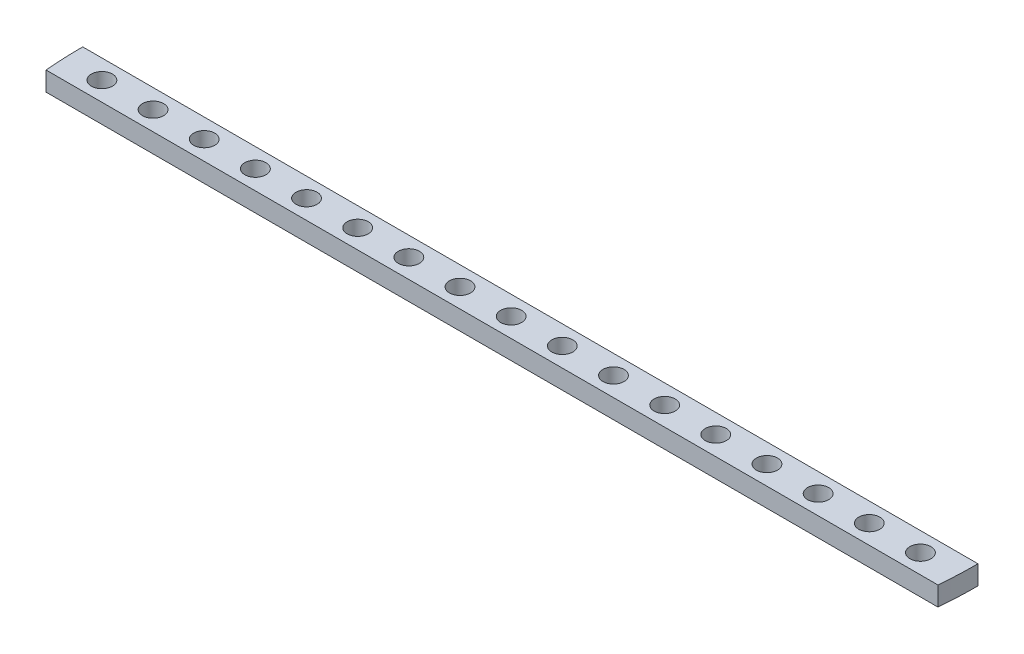
from build123d import *

# Parameters (mm, degrees)
EXTRUDE_1_DEPTH     = 4
CUT_EXTRUDE_1_DEPTH = 10
SKETCH_3_R          = 2.25
CUT_EXTRUDE_2_DEPTH = 10
SKETCH_4_R          = 1.65
CUT_EXTRUDE_3_DEPTH = 10
EXTRUDE_START       = -4
EXTRUDE_2_DEPTH     = 4
SKETCH_6_R          = 1.65
CUT_EXTRUDE_4_DEPTH = 4
SKETCH_7_W          = 40
SKETCH_7_H          = 10
CUT_EXTRUDE_5_DEPTH = 4
EXTRUDE_4_DEPTH     = 4
SKETCH_9_R          = 1.65
SKETCH_9_R_2        = 2.25
SKETCH_9_W          = 20
SKETCH_9_H          = 40
EXTRUDE_7_DEPTH     = 4
CUT_EXTRUDE_START   = -4
SKETCH_10_R         = 2.25
SKETCH_10_W         = 20
SKETCH_10_H         = 40
CUT_EXTRUDE_6_DEPTH = 4
SKETCH_11_R         = 2.25
SKETCH_11_W         = 20
SKETCH_11_H         = 40
SKETCH_11_W_2       = 40
SKETCH_11_H_2       = 20
SKETCH_11_R_2       = 1.65
CUT_EXTRUDE_7_DEPTH = 4
SKETCH_12_W         = 140
SKETCH_12_H         = 1
CUT_EXTRUDE_8_DEPTH = 10


with BuildPart() as part:
    # 草图1 → 凸台-拉伸1 (new body)
    with BuildSketch(Plane(origin=(0, 0, 0), x_dir=(1, 0, 0), z_dir=(0, 1, 0))):
        with BuildLine():
            Line((-50, 0), (50, 0))
            ThreePointArc((50, 0), (0, -50), (-50, 0))
        make_face()
    extrude(amount=EXTRUDE_1_DEPTH)

    # 草图2 → 切除-拉伸1 (cut)
    with BuildSketch(Plane(origin=(0, 4, 0), x_dir=(1, 0, 0), z_dir=(0, 1, 0))):
        Polygon((0, -10.623043888), (10, -10.623043888), (10, -30.623043888), (-30, -30.623043888), (-30, -10.623043888), align=None)
    extrude(amount=-CUT_EXTRUDE_1_DEPTH, mode=Mode.SUBTRACT)

    # 草图3 → 切除-拉伸2 (cut)
    with BuildSketch(Plane(origin=(0, 4, 0), x_dir=(1, 0, 0), z_dir=(0, 1, 0))):
        with Locations(Location((-34.75, -15.623043888, 0), (0, 0, 270))):
            Circle(SKETCH_3_R)
        with Locations(Location((-34.75, -25.623043888, 0), (0, 0, 270))):
            Circle(SKETCH_3_R)
        with Locations(Location((14.75, -25.623043888, 0), (0, 0, 90))):
            Circle(SKETCH_3_R)
        with Locations(Location((14.75, -15.623043888, 0), (0, 0, 90))):
            Circle(SKETCH_3_R)
    extrude(amount=-CUT_EXTRUDE_2_DEPTH, mode=Mode.SUBTRACT)

    # 草图4 → 切除-拉伸3 (cut)
    with BuildSketch(Plane(origin=(0, 4, 0), x_dir=(1, 0, 0), z_dir=(0, 1, 0))):
        with Locations(Location((0, -3, 0), (0, 0, 270))):
            Circle(SKETCH_4_R)
        with Locations(Location((8, -3, 0), (0, 0, 270))):
            Circle(SKETCH_4_R)
        with Locations(Location((16, -3, 0), (0, 0, 270))):
            Circle(SKETCH_4_R)
        with Locations(Location((24, -3, 0), (0, 0, 270))):
            Circle(SKETCH_4_R)
        with Locations(Location((32, -3, 0), (0, 0, 270))):
            Circle(SKETCH_4_R)
        with Locations(Location((40, -3, 0), (0, 0, 270))):
            Circle(SKETCH_4_R)
        with Locations(Location((-40, -3, 0), (0, 0, 90))):
            Circle(SKETCH_4_R)
        with Locations(Location((-32, -3, 0), (0, 0, 90))):
            Circle(SKETCH_4_R)
        with Locations(Location((-24, -3, 0), (0, 0, 90))):
            Circle(SKETCH_4_R)
        with Locations(Location((-16, -3, 0), (0, 0, 90))):
            Circle(SKETCH_4_R)
        with Locations(Location((-8, -3, 0), (0, 0, 90))):
            Circle(SKETCH_4_R)
    extrude(amount=-CUT_EXTRUDE_3_DEPTH, mode=Mode.SUBTRACT)

    # 草图5 → 凸台-拉伸2 (add)
    with BuildSketch(Plane(origin=(0, 4, 0), x_dir=(1, 0, 0), z_dir=(0, 1, 0)).offset(EXTRUDE_START)):
        with BuildLine():
            Line((-50, 0), (-70, 0))
            ThreePointArc((-70, 0), (0, -70), (70, 0))
            Line((70, 0), (50, 0))
            ThreePointArc((50, 0), (0, -50), (-50, 0))
        make_face()
    extrude(amount=EXTRUDE_2_DEPTH)

    # 草图6 → 切除-拉伸4 (cut)
    with BuildSketch(Plane(origin=(0, 4, 0), x_dir=(1, 0, 0), z_dir=(0, 1, 0))):
        with Locations(Location((0, -3, 0), (0, 0, 270))):
            Circle(SKETCH_6_R)
        with Locations(Location((8, -3, 0), (0, 0, 270))):
            Circle(SKETCH_6_R)
        with Locations(Location((16, -3, 0), (0, 0, 270))):
            Circle(SKETCH_6_R)
        with Locations(Location((24, -3, 0), (0, 0, 270))):
            Circle(SKETCH_6_R)
        with Locations(Location((32, -3, 0), (0, 0, 270))):
            Circle(SKETCH_6_R)
        with Locations(Location((40, -3, 0), (0, 0, 270))):
            Circle(SKETCH_6_R)
        with Locations(Location((48, -3, 0), (0, 0, 270))):
            Circle(SKETCH_6_R)
        with Locations(Location((56, -3, 0), (0, 0, 270))):
            Circle(SKETCH_6_R)
        with Locations(Location((64, -3, 0), (0, 0, 270))):
            Circle(SKETCH_6_R)
        with Locations(Location((-8, -3, 0), (0, 0, 90))):
            Circle(SKETCH_6_R)
        with Locations(Location((-16, -3, 0), (0, 0, 90))):
            Circle(SKETCH_6_R)
        with Locations(Location((-24, -3, 0), (0, 0, 90))):
            Circle(SKETCH_6_R)
        with Locations(Location((-32, -3, 0), (0, 0, 90))):
            Circle(SKETCH_6_R)
        with Locations(Location((-40, -3, 0), (0, 0, 90))):
            Circle(SKETCH_6_R)
        with Locations(Location((-48, -3, 0), (0, 0, 270))):
            Circle(SKETCH_6_R)
        with Locations(Location((-56, -3, 0), (0, 0, 270))):
            Circle(SKETCH_6_R)
        with Locations(Location((-64, -3, 0), (0, 0, 270))):
            Circle(SKETCH_6_R)
    extrude(amount=-CUT_EXTRUDE_4_DEPTH, mode=Mode.SUBTRACT)

    # 草图7 → 切除-拉伸5 (cut)
    with BuildSketch(Plane(origin=(0, 4, 0), x_dir=(1, 0, 0), z_dir=(0, 1, 0))):
        with Locations((-10, -25.623043888)):
            Rectangle(SKETCH_7_W, SKETCH_7_H)
        with Locations((-10, -35.623043888)):
            Rectangle(SKETCH_7_W, SKETCH_7_H)
        with BuildLine():
            ThreePointArc((17, -35.623043888), (16.340990258, -34.03205363), (14.75, -33.373043888))
            ThreePointArc((14.75, -33.373043888), (13.159009742, -37.214034146), (17, -35.623043888))
        make_face()
        with BuildLine():
            ThreePointArc((-32.5, -35.623043888), (-33.159009742, -34.03205363), (-34.75, -33.373043888))
            ThreePointArc((-34.75, -33.373043888), (-36.340990258, -37.214034146), (-32.5, -35.623043888))
        make_face()
    extrude(amount=-CUT_EXTRUDE_5_DEPTH, mode=Mode.SUBTRACT)

    # 草图8 → 凸台-拉伸4 (add)
    with BuildSketch(Plane(origin=(0, 4, 0), x_dir=(1, 0, 0), z_dir=(0, 1, 0))):
        Polygon((-41.554882874, -20.623043888), (14.75, -20.623043888), (21.040870392, -20.623043888), (21.040870392, -8.98726117), (-41.554882874, -8.5063719), align=None)
    extrude(amount=-EXTRUDE_4_DEPTH)

    # 草图9 → 凸台-拉伸7 (add)
    # profile 1 of 2: a face of its own
    with BuildSketch(Plane(origin=(0, 4, 0), x_dir=(1, 0, 0), z_dir=(0, 1, 0)).offset(EXTRUDE_START)):
        with BuildLine():
            ThreePointArc((-80, -150), (-26.806171238, -125.50183053), (-10.845240526, -69.154759474))
            ThreePointArc((-10.845240526, -69.154759474), (-49.497474683, -49.497474683), (-69.154759474, -10.845240526))
            ThreePointArc((-69.154759474, -10.845240526), (-74.560935889, -10.211630041), (-80, -10))
            Line((-80, -10), (-80, -150))
        make_face()
        with Locations(Location((-77, -144, 0), (0, 0, 270))):
            Circle(SKETCH_9_R, mode=Mode.SUBTRACT)
        with Locations(Location((-77, -136, 0), (0, 0, 270))):
            Circle(SKETCH_9_R, mode=Mode.SUBTRACT)
        with Locations(Location((-77, -128, 0), (0, 0, 270))):
            Circle(SKETCH_9_R, mode=Mode.SUBTRACT)
        with Locations(Location((-77, -120, 0), (0, 0, 270))):
            Circle(SKETCH_9_R, mode=Mode.SUBTRACT)
        with Locations(Location((-54.376956112, -114.75, 0), (0, 0, 270))):
            Circle(SKETCH_9_R_2, mode=Mode.SUBTRACT)
        with Locations(Location((-44.376956112, -114.75, 0), (0, 0, 270))):
            Circle(SKETCH_9_R_2, mode=Mode.SUBTRACT)
        with Locations(Location((-77, -112, 0), (0, 0, 270))):
            Circle(SKETCH_9_R, mode=Mode.SUBTRACT)
        with Locations(Location((-77, -104, 0), (0, 0, 270))):
            Circle(SKETCH_9_R, mode=Mode.SUBTRACT)
        with Locations(Location((-77, -96, 0), (0, 0, 270))):
            Circle(SKETCH_9_R, mode=Mode.SUBTRACT)
        with Locations(Location((-77, -88, 0), (0, 0, 270))):
            Circle(SKETCH_9_R, mode=Mode.SUBTRACT)
        with Locations(Location((-77, -80, 0), (0, 0, 270))):
            Circle(SKETCH_9_R, mode=Mode.SUBTRACT)
        with Locations((-49.376956112, -90)):
            Rectangle(SKETCH_9_W, SKETCH_9_H, mode=Mode.SUBTRACT)
        with Locations(Location((-77, -72, 0), (0, 0, 270))):
            Circle(SKETCH_9_R, mode=Mode.SUBTRACT)
        with Locations(Location((-77, -64, 0), (0, 0, 270))):
            Circle(SKETCH_9_R, mode=Mode.SUBTRACT)
        with Locations(Location((-54.376956112, -65.25, 0), (0, 0, 270))):
            Circle(SKETCH_9_R_2, mode=Mode.SUBTRACT)
        with Locations(Location((-44.376956112, -65.25, 0), (0, 0, 270))):
            Circle(SKETCH_9_R_2, mode=Mode.SUBTRACT)
        with Locations(Location((-77, -56, 0), (0, 0, 270))):
            Circle(SKETCH_9_R, mode=Mode.SUBTRACT)
        with Locations(Location((-77, -48, 0), (0, 0, 270))):
            Circle(SKETCH_9_R, mode=Mode.SUBTRACT)
        with Locations(Location((-77, -40, 0), (0, 0, 270))):
            Circle(SKETCH_9_R, mode=Mode.SUBTRACT)
        with Locations(Location((-77, -32, 0), (0, 0, 270))):
            Circle(SKETCH_9_R, mode=Mode.SUBTRACT)
        with Locations(Location((-77, -24, 0), (0, 0, 270))):
            Circle(SKETCH_9_R, mode=Mode.SUBTRACT)
        with Locations(Location((-77, -16, 0), (0, 0, 270))):
            Circle(SKETCH_9_R, mode=Mode.SUBTRACT)
    # profile 2 of 2: a face of its own
    with BuildSketch(Plane(origin=(0, 4, 0), x_dir=(1, 0, 0), z_dir=(0, 1, 0)).offset(EXTRUDE_START)):
        with BuildLine():
            ThreePointArc((39.376956112, -57.874479068), (25.73671386, -65.097016519), (10.845240526, -69.154759474))
            ThreePointArc((10.845240526, -69.154759474), (26.806171238, -125.50183053), (80, -150))
            Line((80, -150), (80, -80))
            Line((80, -80), (80, -10))
            ThreePointArc((80, -10), (74.560935889, -10.211630041), (69.154759474, -10.845240526))
            ThreePointArc((69.154759474, -10.845240526), (64.206635613, -27.883829422), (55.133596526, -43.131039103))
            ThreePointArc((55.133596526, -43.131039103), (56.106456706, -46.689210789), (52.430746339, -46.379056031))
            ThreePointArc((52.430746339, -46.379056031), (50.742579289, -48.220230683), (48.989794856, -50))
            Line((48.989794856, -50), (59.376956112, -50))
            Line((59.376956112, -50), (59.376956112, -90))
            Line((59.376956112, -90), (39.376956112, -90))
            Line((39.376956112, -90), (39.376956112, -57.874479068))
        make_face()
        with Locations(Location((77, -144, 0), (0, 0, 270))):
            Circle(SKETCH_9_R, mode=Mode.SUBTRACT)
        with Locations(Location((77, -136, 0), (0, 0, 270))):
            Circle(SKETCH_9_R, mode=Mode.SUBTRACT)
        with Locations(Location((77, -128, 0), (0, 0, 270))):
            Circle(SKETCH_9_R, mode=Mode.SUBTRACT)
        with Locations(Location((77, -120, 0), (0, 0, 270))):
            Circle(SKETCH_9_R, mode=Mode.SUBTRACT)
        with Locations(Location((44.376956112, -94.75, 0), (0, 0, 270))):
            Circle(SKETCH_9_R_2, mode=Mode.SUBTRACT)
        with Locations(Location((54.376956112, -94.75, 0), (0, 0, 270))):
            Circle(SKETCH_9_R_2, mode=Mode.SUBTRACT)
        with Locations(Location((77, -112, 0), (0, 0, 270))):
            Circle(SKETCH_9_R, mode=Mode.SUBTRACT)
        with Locations(Location((77, -104, 0), (0, 0, 270))):
            Circle(SKETCH_9_R, mode=Mode.SUBTRACT)
        with Locations(Location((77, -96, 0), (0, 0, 270))):
            Circle(SKETCH_9_R, mode=Mode.SUBTRACT)
        with Locations(Location((77, -88, 0), (0, 0, 270))):
            Circle(SKETCH_9_R, mode=Mode.SUBTRACT)
        with Locations(Location((77, -80, 0), (0, 0, 270))):
            Circle(SKETCH_9_R, mode=Mode.SUBTRACT)
        with Locations(Location((77, -72, 0), (0, 0, 270))):
            Circle(SKETCH_9_R, mode=Mode.SUBTRACT)
        with Locations(Location((77, -64, 0), (0, 0, 270))):
            Circle(SKETCH_9_R, mode=Mode.SUBTRACT)
        with Locations(Location((77, -56, 0), (0, 0, 270))):
            Circle(SKETCH_9_R, mode=Mode.SUBTRACT)
        with Locations(Location((77, -48, 0), (0, 0, 270))):
            Circle(SKETCH_9_R, mode=Mode.SUBTRACT)
        with Locations(Location((77, -40, 0), (0, 0, 270))):
            Circle(SKETCH_9_R, mode=Mode.SUBTRACT)
        with Locations(Location((77, -32, 0), (0, 0, 270))):
            Circle(SKETCH_9_R, mode=Mode.SUBTRACT)
        with Locations(Location((77, -24, 0), (0, 0, 270))):
            Circle(SKETCH_9_R, mode=Mode.SUBTRACT)
        with Locations(Location((77, -16, 0), (0, 0, 270))):
            Circle(SKETCH_9_R, mode=Mode.SUBTRACT)
    extrude(amount=EXTRUDE_7_DEPTH)

    # 草图10 → 切除-拉伸6 (cut)
    with BuildSketch(Plane(origin=(0, 4, 0), x_dir=(1, 0, 0), z_dir=(0, 1, 0)).offset(CUT_EXTRUDE_START)):
        with Locations(Location((54.376956112, -45.25, 0), (0, 0, 270))):
            Circle(SKETCH_10_R)
        with Locations(Location((44.376956112, -45.25, 0), (0, 0, 270))):
            Circle(SKETCH_10_R)
        with Locations((49.376956112, -70)):
            Rectangle(SKETCH_10_W, SKETCH_10_H)
    extrude(amount=CUT_EXTRUDE_6_DEPTH, mode=Mode.SUBTRACT)

    # 草图11 → 切除-拉伸7 (cut)
    with BuildSketch(Plane.XZ):
        with BuildLine():
            ThreePointArc((-69.154759474, 10.845240526), (-69.490813368, 8.42774332), (-69.742383097, 6))
            Line((-69.742383097, 6), (69.742383097, 6))
            ThreePointArc((69.742383097, 6), (69.490813368, 8.42774332), (69.154759474, 10.845240526))
            ThreePointArc((69.154759474, 10.845240526), (74.560935889, 10.211630041), (80, 10))
            Line((80, 10), (80, 150))
            ThreePointArc((80, 150), (26.806171238, 125.50183053), (10.845240526, 69.154759474))
            ThreePointArc((10.845240526, 69.154759474), (0, 70), (-10.845240526, 69.154759474))
            ThreePointArc((-10.845240526, 69.154759474), (-26.806171238, 125.50183053), (-80, 150))
            Line((-80, 150), (-80, 10))
            ThreePointArc((-80, 10), (-74.560935889, 10.211630041), (-69.154759474, 10.845240526))
        make_face()
        with Locations((54.376956112, 45.25)):
            Circle(SKETCH_11_R, mode=Mode.SUBTRACT)
        with Locations((49.376956112, 70)):
            Rectangle(SKETCH_11_W, SKETCH_11_H, mode=Mode.SUBTRACT)
        with Locations((-34.75, 25.623043888)):
            Circle(SKETCH_11_R, mode=Mode.SUBTRACT)
        with Locations((-34.75, 35.623043888)):
            Circle(SKETCH_11_R, mode=Mode.SUBTRACT)
        with Locations((-10, 30.623043888)):
            Rectangle(SKETCH_11_W_2, SKETCH_11_H_2, mode=Mode.SUBTRACT)
        with Locations((14.75, 25.623043888)):
            Circle(SKETCH_11_R, mode=Mode.SUBTRACT)
        with Locations((14.75, 35.623043888)):
            Circle(SKETCH_11_R, mode=Mode.SUBTRACT)
        with Locations((44.376956112, 45.25)):
            Circle(SKETCH_11_R, mode=Mode.SUBTRACT)
        with Locations((-77, 144)):
            Circle(SKETCH_11_R_2, mode=Mode.SUBTRACT)
        with Locations((-77, 16)):
            Circle(SKETCH_11_R_2, mode=Mode.SUBTRACT)
        with Locations((-77, 24)):
            Circle(SKETCH_11_R_2, mode=Mode.SUBTRACT)
        with Locations((-77, 32)):
            Circle(SKETCH_11_R_2, mode=Mode.SUBTRACT)
        with Locations((-77, 40)):
            Circle(SKETCH_11_R_2, mode=Mode.SUBTRACT)
        with Locations((-77, 48)):
            Circle(SKETCH_11_R_2, mode=Mode.SUBTRACT)
        with Locations((-77, 56)):
            Circle(SKETCH_11_R_2, mode=Mode.SUBTRACT)
        with Locations((-77, 64)):
            Circle(SKETCH_11_R_2, mode=Mode.SUBTRACT)
        with Locations((-77, 72)):
            Circle(SKETCH_11_R_2, mode=Mode.SUBTRACT)
        with Locations((-54.376956112, 65.25)):
            Circle(SKETCH_11_R, mode=Mode.SUBTRACT)
        with Locations((-44.376956112, 65.25)):
            Circle(SKETCH_11_R, mode=Mode.SUBTRACT)
        with Locations((-77, 80)):
            Circle(SKETCH_11_R_2, mode=Mode.SUBTRACT)
        with Locations((-77, 88)):
            Circle(SKETCH_11_R_2, mode=Mode.SUBTRACT)
        with Locations((-77, 96)):
            Circle(SKETCH_11_R_2, mode=Mode.SUBTRACT)
        with Locations((-77, 104)):
            Circle(SKETCH_11_R_2, mode=Mode.SUBTRACT)
        with Locations((-49.376956112, 90)):
            Rectangle(SKETCH_11_W, SKETCH_11_H, mode=Mode.SUBTRACT)
        with Locations((-77, 112)):
            Circle(SKETCH_11_R_2, mode=Mode.SUBTRACT)
        with Locations((-77, 120)):
            Circle(SKETCH_11_R_2, mode=Mode.SUBTRACT)
        with Locations((-77, 128)):
            Circle(SKETCH_11_R_2, mode=Mode.SUBTRACT)
        with Locations((-77, 136)):
            Circle(SKETCH_11_R_2, mode=Mode.SUBTRACT)
        with Locations((-54.376956112, 114.75)):
            Circle(SKETCH_11_R, mode=Mode.SUBTRACT)
        with Locations((-44.376956112, 114.75)):
            Circle(SKETCH_11_R, mode=Mode.SUBTRACT)
        with Locations((77, 144)):
            Circle(SKETCH_11_R_2, mode=Mode.SUBTRACT)
        with Locations((77, 136)):
            Circle(SKETCH_11_R_2, mode=Mode.SUBTRACT)
        with Locations((77, 128)):
            Circle(SKETCH_11_R_2, mode=Mode.SUBTRACT)
        with Locations((77, 16)):
            Circle(SKETCH_11_R_2, mode=Mode.SUBTRACT)
        with Locations((77, 24)):
            Circle(SKETCH_11_R_2, mode=Mode.SUBTRACT)
        with Locations((77, 32)):
            Circle(SKETCH_11_R_2, mode=Mode.SUBTRACT)
        with Locations((77, 40)):
            Circle(SKETCH_11_R_2, mode=Mode.SUBTRACT)
        with Locations((77, 48)):
            Circle(SKETCH_11_R_2, mode=Mode.SUBTRACT)
        with Locations((44.376956112, 94.75)):
            Circle(SKETCH_11_R, mode=Mode.SUBTRACT)
        with Locations((77, 56)):
            Circle(SKETCH_11_R_2, mode=Mode.SUBTRACT)
        with Locations((77, 64)):
            Circle(SKETCH_11_R_2, mode=Mode.SUBTRACT)
        with Locations((77, 72)):
            Circle(SKETCH_11_R_2, mode=Mode.SUBTRACT)
        with Locations((54.376956112, 94.75)):
            Circle(SKETCH_11_R, mode=Mode.SUBTRACT)
        with Locations((77, 80)):
            Circle(SKETCH_11_R_2, mode=Mode.SUBTRACT)
        with Locations((77, 88)):
            Circle(SKETCH_11_R_2, mode=Mode.SUBTRACT)
        with Locations((77, 96)):
            Circle(SKETCH_11_R_2, mode=Mode.SUBTRACT)
        with Locations((77, 104)):
            Circle(SKETCH_11_R_2, mode=Mode.SUBTRACT)
        with Locations((77, 112)):
            Circle(SKETCH_11_R_2, mode=Mode.SUBTRACT)
        with Locations((77, 120)):
            Circle(SKETCH_11_R_2, mode=Mode.SUBTRACT)
    extrude(amount=-CUT_EXTRUDE_7_DEPTH, mode=Mode.SUBTRACT)

    # 草图12 → 切除-拉伸8 (cut)
    with BuildSketch(Plane(origin=(0, 0, 0), x_dir=(-1, 0, 0), z_dir=(0, 0, -1))):
        with Locations((0, 3.5)):
            Rectangle(SKETCH_12_W, SKETCH_12_H)
    extrude(amount=-CUT_EXTRUDE_8_DEPTH, mode=Mode.SUBTRACT)


solid = part.part
